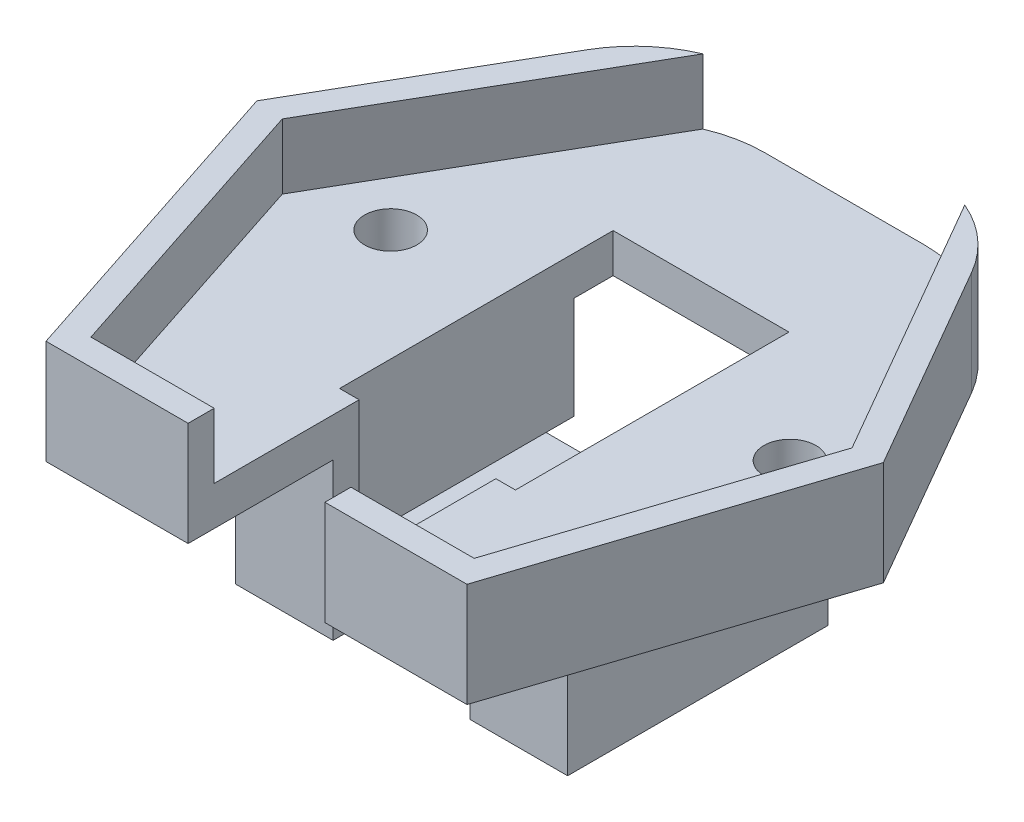
from build123d import *

# Parameters (mm, degrees)
BOSS_EXTRUDE1_DEPTH = 5
BOSS_EXTRUDE2_DEPTH = 3
SKETCH3_W           = 7.507408842
SKETCH3_H           = 20
BOSS_EXTRUDE3_DEPTH = 12
CUT_EXTRUDE2_DEPTH  = 18
SKETCH6_R           = 2
CUT_EXTRUDE3_DEPTH  = 48.063378728
SKETCH7_W           = 24.049396926
SKETCH7_H           = 4
CUT_EXTRUDE4_DEPTH  = 10
FILLET1_R           = 10


with BuildPart() as part:
    # Sketch1 → Boss-Extrude1 (new body)
    with BuildSketch(Plane(origin=(0, 0, 0), x_dir=(1, 0, 0), z_dir=(0, 1, 0))):
        Polygon((-10.454849344, 8.996116817), (-24.051323202, -14.553666709), (-16.16163723, -38.632828909), (16.16163723, -38.632828909), (24.051323202, -14.553666709), (10.454849344, 8.996116817), align=None)
        Polygon((9.300148806, 6.996116817), (-9.300148806, 6.996116817), (-21.872561183, -14.779940194), (-14.712327446, -36.632828909), (14.712327446, -36.632828909), (21.872561183, -14.779940194), align=None, mode=Mode.SUBTRACT)
    extrude(amount=BOSS_EXTRUDE1_DEPTH)

    # Sketch2 → Boss-Extrude2 (add)
    with BuildSketch(Plane(origin=(0, 0, 0), x_dir=(-1, 0, 0), z_dir=(0, -1, 0))):
        Polygon((24.051323202, -14.553666709), (10.454849344, 8.996116817), (-10.454849344, 8.996116817), (-24.051323202, -14.553666709), (-16.16163723, -38.632828909), (16.16163723, -38.632828909), align=None)
    extrude(amount=BOSS_EXTRUDE2_DEPTH)

    # Sketch3 → Boss-Extrude3 (add)
    with BuildSketch(Plane(origin=(0, -3, 0), x_dir=(-1, 0, 0), z_dir=(0, -1, 0))):
        with Locations((9.003704421, -17.503883183)):
            Rectangle(SKETCH3_W, SKETCH3_H)
        with Locations((-9.003704421, -17.503883183)):
            Rectangle(SKETCH3_W, SKETCH3_H)
    extrude(amount=BOSS_EXTRUDE3_DEPTH)

    # Sketch5 → Cut-Extrude2 (cut)
    with BuildSketch(Plane(origin=(0, 0, 7.503883183), x_dir=(-1, 0, 0), z_dir=(0, 0, -1))):
        Polygon((-9.75, -13), (9.75, -13), (9.75, -10.85), (6.75, -10.85), (6.75, -3), (5.25, -3), (5.25, -10.85), (-5.25, -10.85), (-5.25, -3), (-6.75, -3), (-6.75, -10.85), (-9.75, -10.85), align=None)
    extrude(amount=-CUT_EXTRUDE2_DEPTH, mode=Mode.SUBTRACT)

    # Sketch6 → Cut-Extrude3 (cut, through all)
    with BuildSketch(Plane(origin=(0, -3, 0), x_dir=(-1, 0, 0), z_dir=(0, -1, 0))):
        with Locations(Location((-15.327870678, -13.003883183, 0), (0, 0, 90))):
            Circle(SKETCH6_R)
        with Locations(Location((15.327870678, -13.003883183, 0), (0, 0, 90))):
            Circle(SKETCH6_R)
        Polygon((-5.25, -38.632828909), (5.25, -38.632828909), (5.25, -25.503883183), (6.75, -25.503883183), (6.75, -4.503883183), (-6.75, -4.503883183), (-6.75, -25.503883183), (-5.25, -25.503883183), align=None)
    extrude(amount=-CUT_EXTRUDE3_DEPTH, mode=Mode.SUBTRACT)

    # Sketch7 → Cut-Extrude4 (cut)
    with BuildSketch(Plane(origin=(0, -3, 0), x_dir=(-1, 0, 0), z_dir=(0, -1, 0))):
        with Locations((0, 8.496116817)):
            Rectangle(SKETCH7_W, SKETCH7_H)
    extrude(amount=-CUT_EXTRUDE4_DEPTH, mode=Mode.SUBTRACT)

    # Fillet1
    fillet1_edges = [part.edges().sort_by_distance(p)[0] for p in [
        (-11.898225017, 1, -6.496116817),
        (11.898225017, 1, -6.496116817),
    ]]
    fillet(fillet1_edges, radius=FILLET1_R)


solid = part.part
